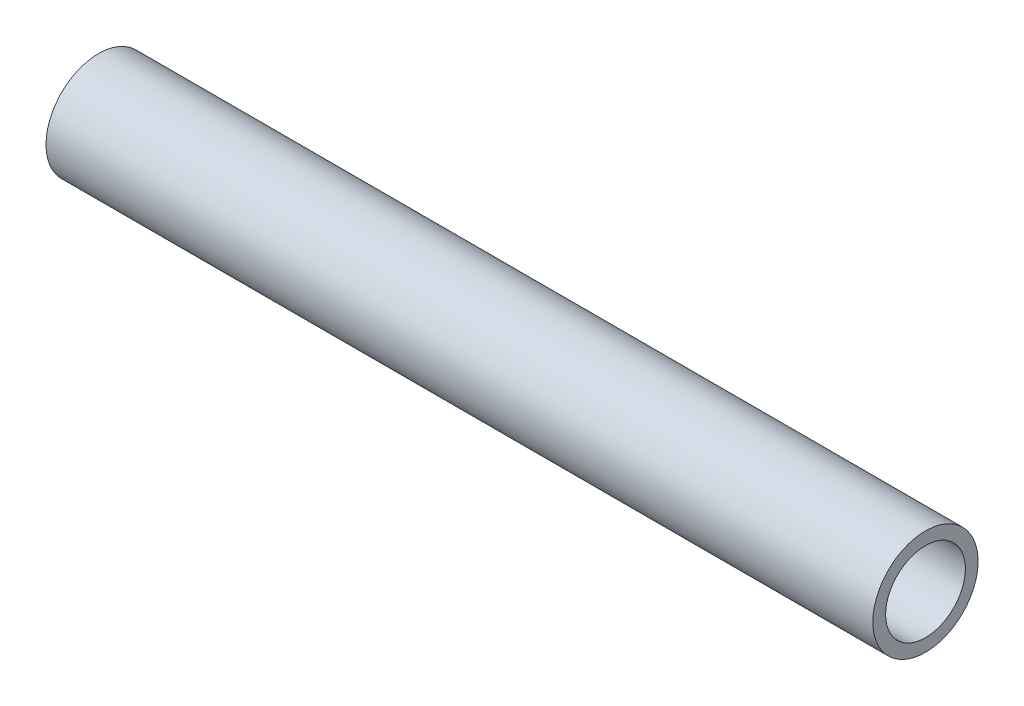
from build123d import *

# Parameters (mm, degrees)
SZKIC1_W = 110
SZKIC1_H = 1.694271821


with BuildPart() as part:
    # Szkic1 → Obrót1 (revolve)
    with BuildSketch(Plane.XY, mode=Mode.PRIVATE) as obr_t1_sk:
        with Locations((55, 6.152864089)):
            Rectangle(SZKIC1_W, SZKIC1_H)
    revolve(obr_t1_sk.sketch.rotate(Axis((0, 0, 0), (1, 0, 0)), 90), axis=Axis((0, 0, 0), (1, 0, 0)))


solid = part.part
